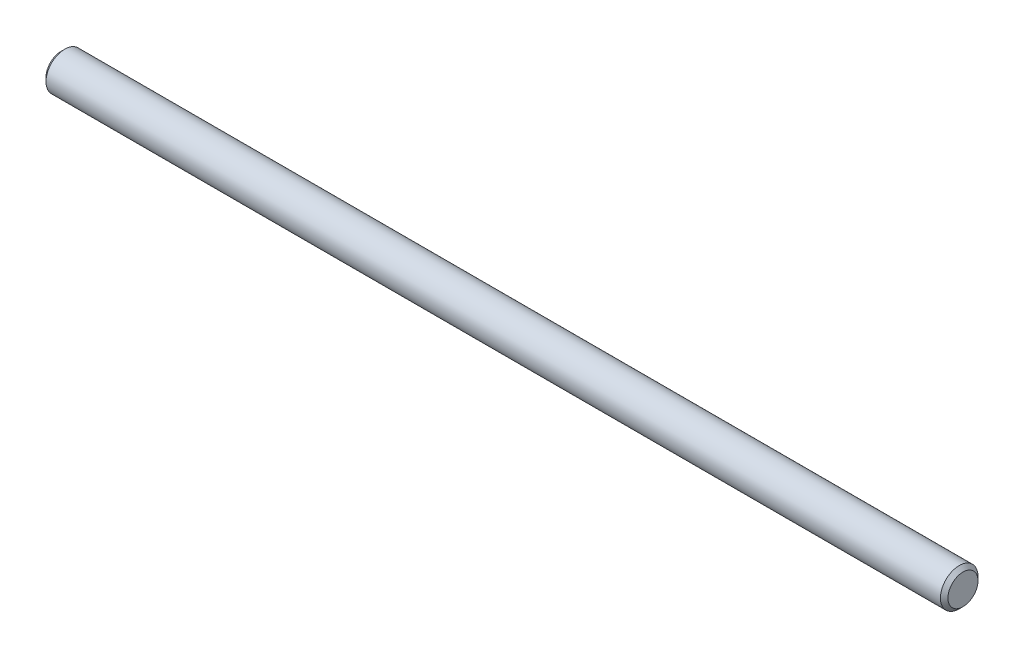
from build123d import *

# Parameters (mm, degrees)
SKETCH1_R           = 4
BOSS_EXTRUDE1_DEPTH = 96
CHAMFER1_SIZE       = 0.8


with BuildPart() as part:
    # Sketch1 → Boss-Extrude1 (new, symmetric)
    with BuildSketch(Plane(origin=(0, 0, 0), x_dir=(0, 0, -1), z_dir=(1, 0, 0))):
        Circle(SKETCH1_R)
    extrude(amount=BOSS_EXTRUDE1_DEPTH, both=True)

    # Chamfer1
    chamfer1_edges = [part.edges().sort_by_distance(p)[0] for p in [
        (-96, 0, 4),
        (96, 0, 4),
    ]]
    chamfer(chamfer1_edges, length=CHAMFER1_SIZE)


solid = part.part
